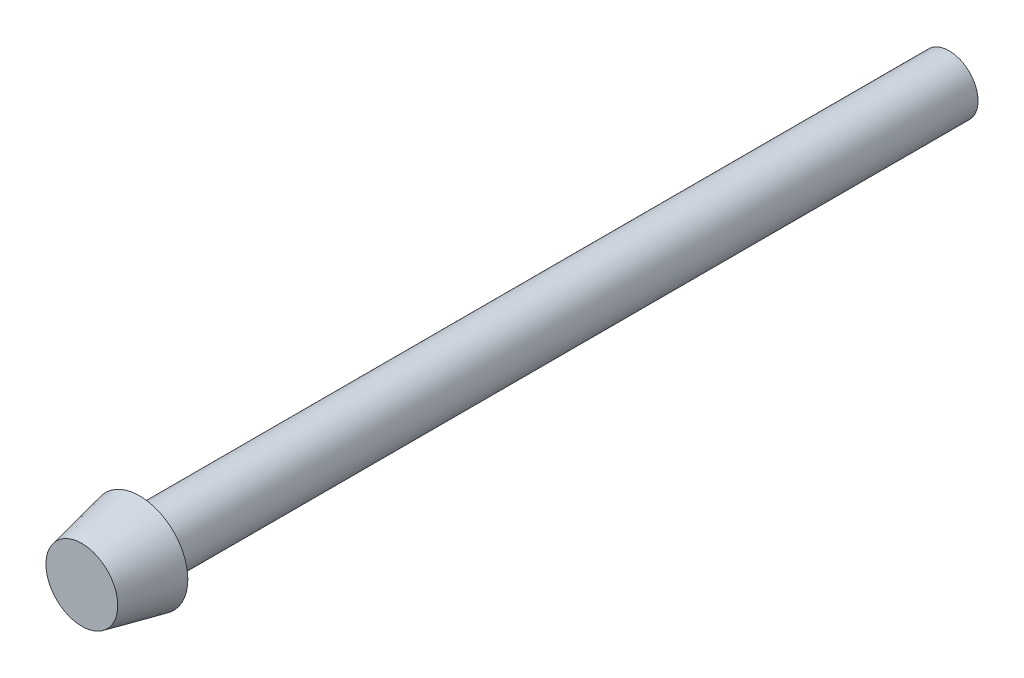
from build123d import *

# Parameters (mm, degrees)
ESQUISSE1_R        = 1.5
BOSS_EXTRU_1_DEPTH = 42
ESQUISSE2_R        = 2.5
BOSS_EXTRU_2_DEPTH = 3
BOSS_EXTRU_2_TAPER = 12


with BuildPart() as part:
    # Esquisse1 → Boss.-Extru.1 (new body)
    with BuildSketch(Plane.XY):
        with Locations(Location((0, 0, 0), (0, 0, 180))):
            Circle(ESQUISSE1_R)
    extrude(amount=BOSS_EXTRU_1_DEPTH)

    # Esquisse2 → Boss.-Extru.2 (add)
    with BuildSketch(Plane.XY.offset(42)):
        Circle(ESQUISSE2_R)
    extrude(amount=BOSS_EXTRU_2_DEPTH, taper=BOSS_EXTRU_2_TAPER)


solid = part.part
